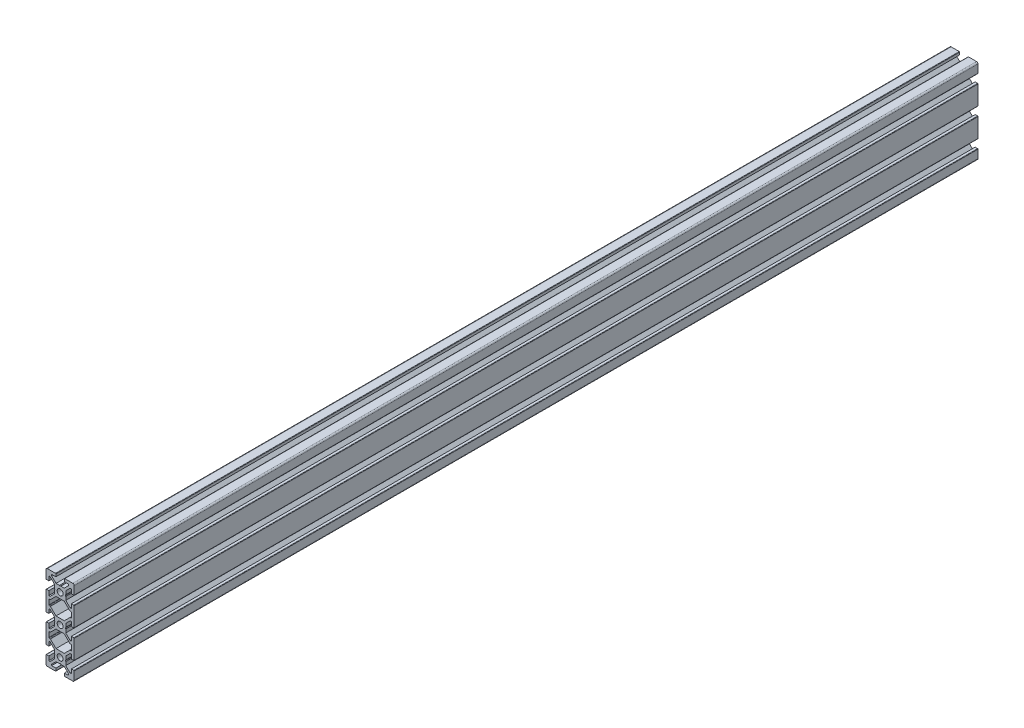
from build123d import *

# Parameters (mm, degrees)
SKETCH_1_R      = 2.0999999
EXTRUDE_1_DEPTH = 640


with BuildPart() as part:
    # 草圖1 → 填料-伸長1 (new body)
    with BuildSketch(Plane.XY):
        with BuildLine():
            Line((-10, 16.7), (-10, 3.3))
            ThreePointArc((-10, 3.3), (-9.912132034, 3.087867966), (-9.7, 3))
            Line((-9.7, 3), (-8, 3))
            Line((-8, 3), (-8, 6))
            Line((-8, 6), (-7.060650687, 6))
            Line((-7.060650687, 6), (-4, 2.939349))
            Line((-4, 2.939349), (-4, 0.519615242))
            Line((-4, 0.519615242), (-3.7, 0))
            Line((-3.7, 0), (-4, -0.519615242))
            Line((-4, -0.519615242), (-4, -2.9393502))
            Line((-4, -2.9393502), (-7.060649487, -6))
            Line((-7.060649487, -6), (-8, -6))
            Line((-8, -6), (-8, -3))
            Line((-8, -3), (-9.7, -3))
            ThreePointArc((-9.7, -3), (-9.912132034, -3.087867966), (-10, -3.3))
            Line((-10, -3.3), (-10, -16.7))
            ThreePointArc((-10, -16.7), (-9.912132034, -16.912132034), (-9.7, -17))
            Line((-9.7, -17), (-8, -17))
            Line((-8, -17), (-8, -14))
            Line((-8, -14), (-7.060672887, -14))
            Line((-7.060672887, -14), (-4, -17.0606732))
            Line((-4, -17.0606732), (-4, -19.480384758))
            Line((-4, -19.480384758), (-3.7, -20))
            Line((-3.7, -20), (-4, -20.519615242))
            Line((-4, -20.519615242), (-4, -22.93935665))
            Line((-4, -22.93935665), (-7.060643037, -26))
            Line((-7.060643037, -26), (-8, -26))
            Line((-8, -26), (-8, -23))
            Line((-8, -23), (-9.7, -23))
            ThreePointArc((-9.7, -23), (-9.912132034, -23.087867966), (-10, -23.3))
            Line((-10, -23.3), (-10, -29))
            ThreePointArc((-10, -29), (-9.707106781, -29.707106781), (-9, -30))
            Line((-9, -30), (-3.3, -30))
            ThreePointArc((-3.3, -30), (-3.087867966, -29.912132034), (-3, -29.7))
            Line((-3, -29.7), (-3, -28))
            Line((-3, -28), (-6, -28))
            Line((-6, -28), (-6, -27.060683408))
            Line((-6, -27.060683408), (-2.939316, -24))
            Line((-2.939316, -24), (-0.519095055, -24))
            Line((-0.519095055, -24), (1e-06, -23.7))
            Line((1e-06, -23.7), (0.518577868, -24))
            Line((0.518577868, -24), (2.939318, -24))
            Line((2.939318, -24), (6, -27.060682403))
            Line((6, -27.060682403), (6, -28))
            Line((6, -28), (3, -28))
            Line((3, -28), (3, -29.7))
            ThreePointArc((3, -29.7), (3.087867966, -29.912132034), (3.3, -30))
            Line((3.3, -30), (9, -30))
            ThreePointArc((9, -30), (9.707106781, -29.707106781), (10, -29))
            Line((10, -29), (10, -23.3))
            ThreePointArc((10, -23.3), (9.912132034, -23.087867966), (9.7, -23))
            Line((9.7, -23), (8, -23))
            Line((8, -23), (8, -26))
            Line((8, -26), (7.060637687, -26))
            Line((7.060637687, -26), (4, -22.93935641))
            Line((4, -22.93935641), (4, -20.519623992))
            Line((4, -20.519623992), (3.7, -20.00000875))
            Line((3.7, -20.00000875), (4, -19.480393508))
            Line((4, -19.480393508), (4, -17.06066109))
            Line((4, -17.06066109), (7.060655187, -14))
            Line((7.060655187, -14), (8, -14))
            Line((8, -14), (8, -17))
            Line((8, -17), (9.7, -17))
            ThreePointArc((9.7, -17), (9.912132034, -16.912132034), (10, -16.7))
            Line((10, -16.7), (10, -3.3))
            ThreePointArc((10, -3.3), (9.912132034, -3.087867966), (9.7, -3))
            Line((9.7, -3), (8, -3))
            Line((8, -3), (8, -6))
            Line((8, -6), (7.060651537, -6))
            Line((7.060651537, -6), (4, -2.93934815))
            Line((4, -2.93934815), (4, -0.519623992))
            Line((4, -0.519623992), (3.7, -8.75e-06))
            Line((3.7, -8.75e-06), (4, 0.519606492))
            Line((4, 0.519606492), (4, 2.9393426))
            Line((4, 2.9393426), (7.060657087, 6))
            Line((7.060657087, 6), (8, 6))
            Line((8, 6), (8, 3))
            Line((8, 3), (9.7, 3))
            ThreePointArc((9.7, 3), (9.912132034, 3.087867966), (10, 3.3))
            Line((10, 3.3), (10, 16.7))
            ThreePointArc((10, 16.7), (9.912132034, 16.912132034), (9.7, 17))
            Line((9.7, 17), (8, 17))
            Line((8, 17), (8, 14))
            Line((8, 14), (7.06065821, 14))
            Line((7.06065821, 14), (4, 17.060658523))
            Line((4, 17.060658523), (4, 19.480376008))
            Line((4, 19.480376008), (3.7, 19.99999125))
            Line((3.7, 19.99999125), (4, 20.519606492))
            Line((4, 20.519606492), (4, 22.939362173))
            Line((4, 22.939362173), (7.060637514, 26))
            Line((7.060637514, 26), (8, 26))
            Line((8, 26), (8, 23))
            Line((8, 23), (9.7, 23))
            ThreePointArc((9.7, 23), (9.912132034, 23.087867966), (10, 23.3))
            Line((10, 23.3), (10, 29))
            ThreePointArc((10, 29), (9.707106781, 29.707106781), (9, 30))
            Line((9, 30), (3.3, 30))
            ThreePointArc((3.3, 30), (3.087867966, 29.912132034), (3, 29.7))
            Line((3, 29.7), (3, 28))
            Line((3, 28), (6, 28))
            Line((6, 28), (6, 27.060684313))
            Line((6, 27.060684313), (2.939316, 24))
            Line((2.939316, 24), (0.519614242, 24))
            Line((0.519614242, 24), (-1e-06, 23.7))
            Line((-1e-06, 23.7), (-0.519616242, 24))
            Line((-0.519616242, 24), (-2.939318, 24))
            Line((-2.939318, 24), (-6, 27.060682313))
            Line((-6, 27.060682313), (-6, 28))
            Line((-6, 28), (-3, 28))
            Line((-3, 28), (-3, 29.7))
            ThreePointArc((-3, 29.7), (-3.087867966, 29.912132034), (-3.3, 30))
            Line((-3.3, 30), (-9, 30))
            ThreePointArc((-9, 30), (-9.707106781, 29.707106781), (-10, 29))
            Line((-10, 29), (-10, 23.3))
            ThreePointArc((-10, 23.3), (-9.912132034, 23.087867966), (-9.7, 23))
            Line((-9.7, 23), (-8, 23))
            Line((-8, 23), (-8, 26))
            Line((-8, 26), (-7.060644014, 26))
            Line((-7.060644014, 26), (-4, 22.939355673))
            Line((-4, 22.939355673), (-4, 20.519615242))
            Line((-4, 20.519615242), (-3.7, 20))
            Line((-3.7, 20), (-4, 19.480384758))
            Line((-4, 19.480384758), (-4, 17.060669373))
            Line((-4, 17.060669373), (-7.06066906, 14))
            Line((-7.06066906, 14), (-8, 14))
            Line((-8, 14), (-8, 17))
            Line((-8, 17), (-9.7, 17))
            ThreePointArc((-9.7, 17), (-9.912132034, 16.912132034), (-10, 16.7))
        make_face()
        with Locations((0, 20.000013123)):
            Circle(SKETCH_1_R, mode=Mode.SUBTRACT)
        Circle(SKETCH_1_R, mode=Mode.SUBTRACT)
        with Locations((0, -20.000013525)):
            Circle(SKETCH_1_R, mode=Mode.SUBTRACT)
        with BuildLine():
            Line((-7.7, 8), (-7.063594325, 8))
            ThreePointArc((-7.063594325, 8), (-6.948789288, 7.977163857), (-6.85146228, 7.912132024))
            Line((-6.85146228, 7.912132024), (-2.939330656, 4))
            Line((-2.939330656, 4), (2.939337056, 4))
            Line((2.939337056, 4), (6.85146868, 7.912132024))
            ThreePointArc((6.85146868, 7.912132024), (6.948795688, 7.977163857), (7.063600725, 8))
            Line((7.063600725, 8), (7.7, 8))
            ThreePointArc((7.7, 8), (7.912132034, 8.087867966), (8, 8.3))
            Line((8, 8.3), (8, 11.7))
            ThreePointArc((8, 11.7), (7.912132034, 11.912132034), (7.7, 12))
            Line((7.7, 12), (7.063601848, 12))
            ThreePointArc((7.063601848, 12), (6.948796811, 12.022836143), (6.851469803, 12.087867976))
            Line((6.851469803, 12.087867976), (2.939338179, 16))
            Line((2.939338179, 16), (-2.939349029, 16))
            Line((-2.939349029, 16), (-6.851480653, 12.087867976))
            ThreePointArc((-6.851480653, 12.087867976), (-6.948807661, 12.022836143), (-7.063612698, 12))
            Line((-7.063612698, 12), (-7.7, 12))
            ThreePointArc((-7.7, 12), (-7.912132034, 11.912132034), (-8, 11.7))
            Line((-8, 11.7), (-8, 8.3))
            ThreePointArc((-8, 8.3), (-7.912132034, 8.087867966), (-7.7, 8))
        make_face(mode=Mode.SUBTRACT)
        with BuildLine():
            Line((-8, -8.3), (-8, -11.7))
            ThreePointArc((-8, -11.7), (-7.912132034, -11.912132034), (-7.7, -12))
            Line((-7.7, -12), (-7.063616525, -12))
            ThreePointArc((-7.063616525, -12), (-6.948811488, -12.022836143), (-6.85148448, -12.087867976))
            Line((-6.85148448, -12.087867976), (-2.939352856, -16))
            Line((-2.939352856, -16), (2.939340746, -16))
            Line((2.939340746, -16), (6.851465031, -12.08786817))
            ThreePointArc((6.851465031, -12.08786817), (6.948792107, -12.022836196), (7.06359727, -12))
            Line((7.06359727, -12), (7.7, -12))
            ThreePointArc((7.7, -12), (7.912132034, -11.912132034), (8, -11.7))
            Line((8, -11.7), (8, -8.3))
            ThreePointArc((8, -8.3), (7.912132034, -8.087867966), (7.7, -8))
            Line((7.7, -8), (7.063595175, -8))
            ThreePointArc((7.063595175, -8), (6.948790138, -7.977163857), (6.85146313, -7.912132024))
            Line((6.85146313, -7.912132024), (2.939331506, -4))
            Line((2.939331506, -4), (-2.939329456, -4))
            Line((-2.939329456, -4), (-6.85146108, -7.912132024))
            ThreePointArc((-6.85146108, -7.912132024), (-6.948788088, -7.977163857), (-7.063593125, -8))
            Line((-7.063593125, -8), (-7.7, -8))
            ThreePointArc((-7.7, -8), (-7.912132034, -8.087867966), (-8, -8.3))
        make_face(mode=Mode.SUBTRACT)
    extrude(amount=-EXTRUDE_1_DEPTH)


solid = part.part
